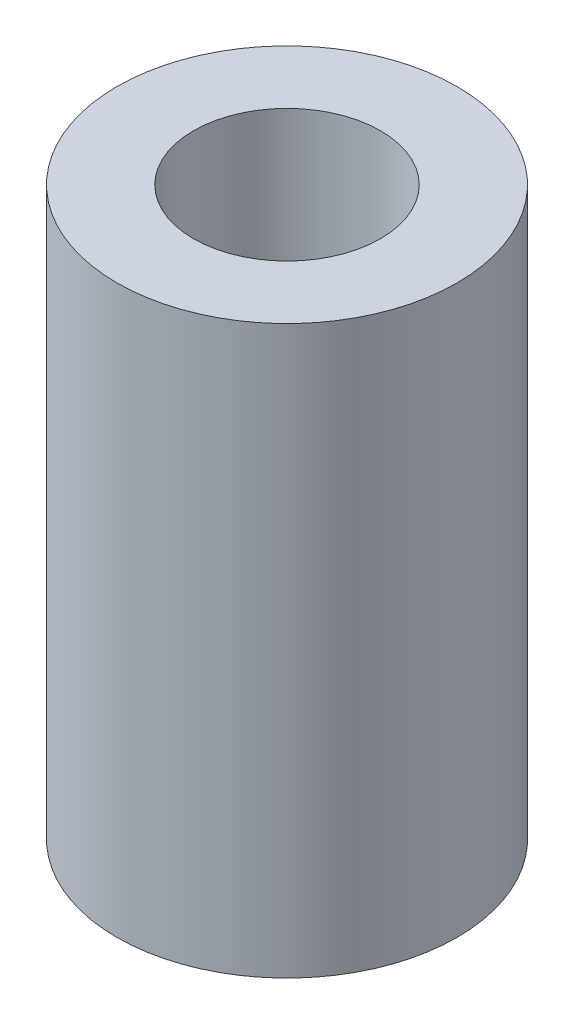
from build123d import *

# Parameters (mm, degrees)
SKETCH1_R             = 3
BOSS_EXTRUDE1_DEPTH   = 10
M4X0_7_TAPPED_HOLE1_D = 3.3


with BuildPart() as part:
    # Sketch1 → Boss-Extrude1 (new body)
    with BuildSketch(Plane(origin=(0, 0, 0), x_dir=(1, 0, 0), z_dir=(0, 1, 0))):
        with Locations(Location((0, 0, 0), (0, 0, 270))):
            Circle(SKETCH1_R)
    extrude(amount=BOSS_EXTRUDE1_DEPTH)

    # M4x0.7 Tapped Hole1 (through all)
    with Locations(Plane(origin=(0, 10, 0), x_dir=(1, 0, 0), z_dir=(0, 1, 0))):
        with Locations((0, 0)):
            Hole(M4X0_7_TAPPED_HOLE1_D / 2)


solid = part.part
